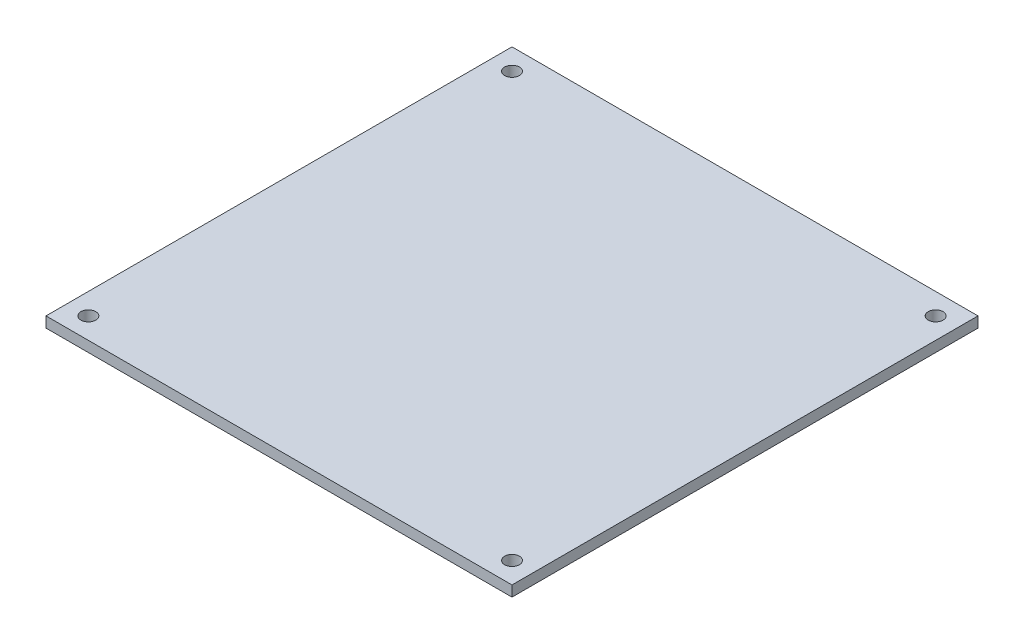
from build123d import *

# Parameters (mm, degrees)
SKETCH1_W               = 220
SKETCH1_H               = 220
BOSS_EXTRUDE1_DEPTH     = 2.5
SKETCH4_R               = 3.5
CUT_EXTRUDE1_DEPTH      = 5
MIRROR4_COPY_1_SKETCH_R = 3.5
MIRROR4_COPY_1_DEPTH    = 5


with BuildPart() as part:
    # Sketch1 → Boss-Extrude1 (new, symmetric)
    with BuildSketch(Plane(origin=(0, 0, 0), x_dir=(1, 0, 0), z_dir=(0, 1, 0))):
        Rectangle(SKETCH1_W, SKETCH1_H)
    extrude(amount=BOSS_EXTRUDE1_DEPTH, both=True)

    # Sketch4 → Cut-Extrude1 (cut)
    with BuildSketch(Plane(origin=(0, 2.5, 0), x_dir=(1, 0, 0), z_dir=(0, 1, 0))):
        with Locations(Location((-100, 100, 0), (0, 0, 270))):
            Circle(SKETCH4_R)
    cut_extrude1 = extrude(amount=-CUT_EXTRUDE1_DEPTH, mode=Mode.SUBTRACT)

    # Mirror3: Cut-Extrude1 across plane
    add(cut_extrude1.mirror(Plane(origin=(0, 0, 0), x_dir=(0, 0, 1), z_dir=(1, 0, 0))), mode=Mode.SUBTRACT)

    # Mirror4: Cut-Extrude1 across plane
    add(cut_extrude1.mirror(Plane.XY), mode=Mode.SUBTRACT)

    # Mirror4 copy 1 sketch → Mirror4 copy 1 (cut)
    with BuildSketch(Plane(origin=(0, 2.5, 0), x_dir=(-1, 0, 0), z_dir=(0, 1, 0))):
        with Locations(Location((-100, 100, 0), (0, 0, 270))):
            Circle(MIRROR4_COPY_1_SKETCH_R)
    extrude(amount=-MIRROR4_COPY_1_DEPTH, mode=Mode.SUBTRACT)


solid = part.part
